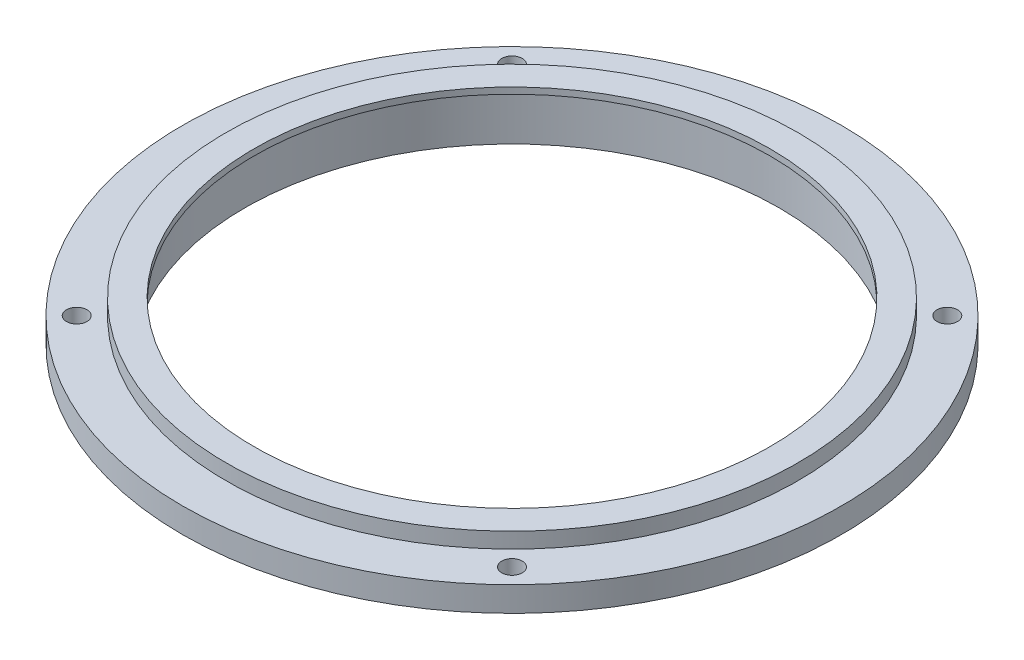
from build123d import *

# Parameters (mm, degrees)
HOLE_WIZARD_M4_1_D = 3.3


with BuildPart() as part:
    # 草图1 → 旋转1 (revolve)
    with BuildSketch(Plane.XY, mode=Mode.PRIVATE) as revolve_1_sk:
        Polygon((41.5, 9), (46, 9), (46, 6.5), (53, 6.5), (53, 2.5), (46, 2.5), (46, 0), (43, 0), (43, 8), (41.5, 8), align=None)
    revolve(revolve_1_sk.sketch.rotate(Axis((0, 0, 0), (0, 1, 0)), 90), axis=Axis((0, 0, 0), (0, 1, 0)))

    # M4 螺纹孔1 (through all)
    with Locations(Plane(origin=(0, 2.5, 0), x_dir=(-1, 0, 0), z_dir=(0, -1, 0))):
        with Locations((-35.001785669, 35.001785669), (35.001785669, 35.001785669), (35.001785669, -35.001785669), (-35.001785669, -35.001785669)):
            Hole(HOLE_WIZARD_M4_1_D / 2)


solid = part.part
